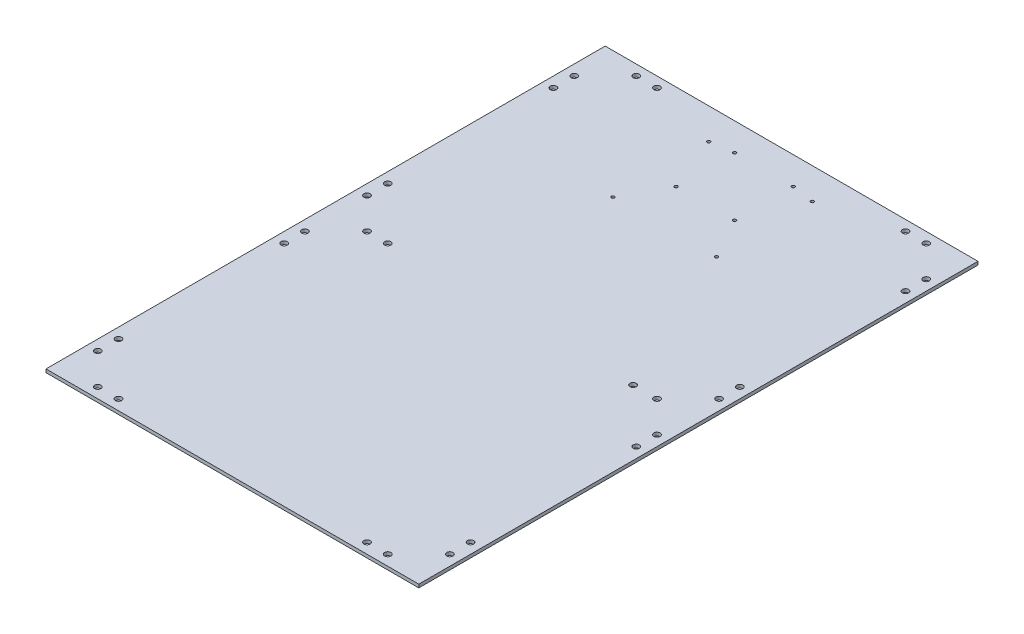
from build123d import *

# Parameters (mm, degrees)
SKETCH1_W             = 360
SKETCH1_H             = 540
BOSS_EXTRUDE1_DEPTH   = 3.175
F_3_0MM_DOWEL_HOLE1_D = 3
F_6_0MM_DOWEL_HOLE2_D = 6


with BuildPart() as part:
    # Sketch1 → Boss-Extrude1 (new body)
    with BuildSketch(Plane(origin=(0, 0, 0), x_dir=(1, 0, 0), z_dir=(0, 1, 0))):
        with Locations((180, -270)):
            Rectangle(SKETCH1_W, SKETCH1_H)
    extrude(amount=BOSS_EXTRUDE1_DEPTH)

    # Ø3.0mm Dowel Hole1 (through all)
    with Locations(Plane(origin=(0, 3.175, 0), x_dir=(1, 0, 0), z_dir=(0, 1, 0))):
        with Locations((151.715728753, -26.715728753), (208.284271247, -26.715728753), (208.284271247, -83.284271247), (151.715728753, -83.284271247), (130, -122.5), (230, -122.5), (230, -30), (130, -30)):
            Hole(F_3_0MM_DOWEL_HOLE1_D / 2)

    # Ø6.0mm Dowel Hole2 (through all)
    with Locations(Plane(origin=(0, 3.175, 0), x_dir=(1, 0, 0), z_dir=(0, 1, 0))):
        with Locations((10, -500), (40, -270), (10, -220), (40, -530), (320, -530), (350, -500), (10, -300), (10, -240), (320, -270), (350, -40), (320, -10), (40, -10), (10, -40), (60, -270), (10, -320), (10, -60), (60, -10), (300, -10), (350, -60), (350, -220), (350, -240), (296.924884631, -270), (350, -300), (350, -320), (350, -480), (300, -530), (10, -480), (60, -530)):
            Hole(F_6_0MM_DOWEL_HOLE2_D / 2)


solid = part.part
